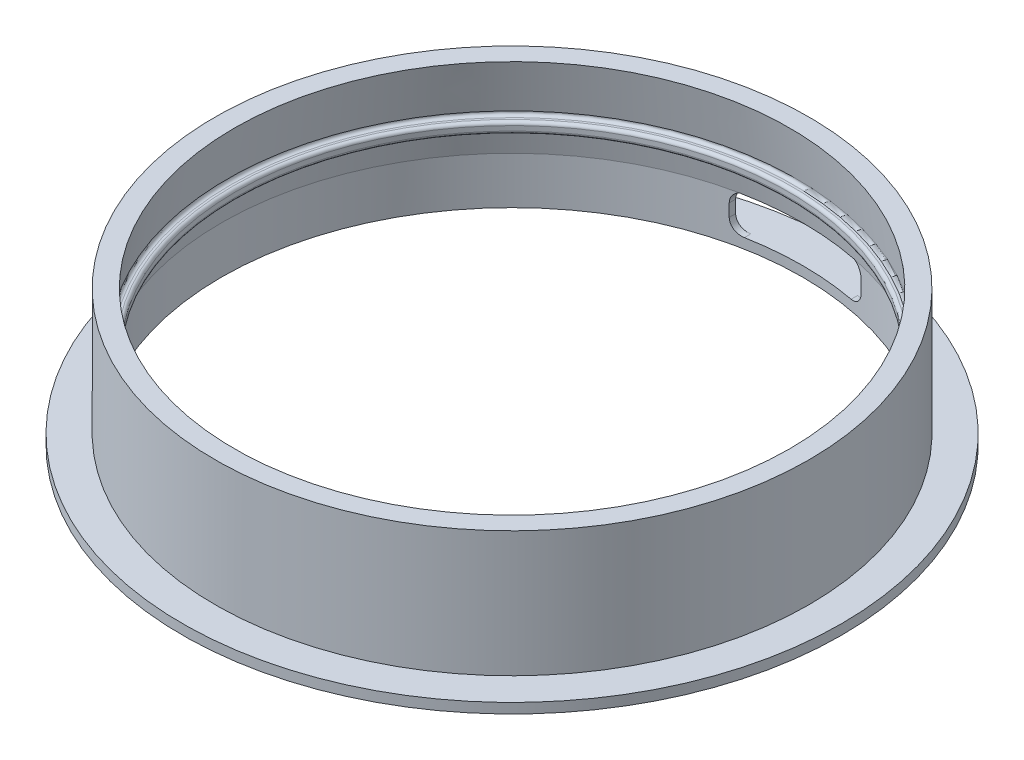
from build123d import *

# Parameters (mm, degrees)
CUT_EXTRUDE1_REACH      = 79.324
CUT_EXTRUDE1_END_RADIUS = 47.3
SKETCH4_W               = 21
SKETCH4_H               = 6
FILLET1_R               = 2
FILLET2_R               = 0.5


with BuildPart() as part:
    # Sketch2 → Revolve1 (revolve)
    with BuildSketch(Plane.XY):
        Polygon((46.3, 0), (46.3, 21.6), (47.3, 21.6), (47.3, 1.6), (52.5, 1.6), (52.5, 0), align=None)
    revolve(axis=Axis((0, -1000, 0), (0, 1, 0)))

    # Cut-Extrude1: up to this cylinder (the profile starts inside it)
    cut_extrude1_end = Plane(origin=(0, 4.6, 0), z_dir=(0, -1, 0)) * Cylinder(CUT_EXTRUDE1_END_RADIUS, 254.248, mode=Mode.PRIVATE)
    # Sketch4 → Cut-Extrude1 (cut, up to the surface)
    with BuildSketch(Plane.XY, mode=Mode.PRIVATE) as cut_extrude1_sk1:
        with Locations((0, 4.6)):
            Rectangle(SKETCH4_W, SKETCH4_H)
    cut_extrude1_tool1 = extrude(cut_extrude1_sk1.sketch, amount=-CUT_EXTRUDE1_REACH, mode=Mode.PRIVATE) & cut_extrude1_end
    add(cut_extrude1_tool1.solids().sort_by_distance((0, 4.6, 0))[0], mode=Mode.SUBTRACT)

    # Fillet1
    fillet1_edges = [part.edges().sort_by_distance(p)[0] for p in [
        (10.5, 1.6, -45.606762076),
        (-10.5, 7.6, -45.606762076),
        (10.5, 7.6, -45.606762076),
        (-10.5, 1.6, -45.606762076),
    ]]
    fillet(fillet1_edges, radius=FILLET1_R)

    # Sketch6 → Revolve2 (revolve)
    with BuildSketch(Plane.XY, mode=Mode.PRIVATE) as revolve2_sk:
        Polygon((-46.3, 7.5), (-44.243032454, 21.6), (-46.3, 21.6), align=None)
        Polygon((-45.431988872, 13.45), (-45.687286263, 11.7), (-44, 11.7), (-44, 13.45), align=None)
    revolve(revolve2_sk.sketch.rotate(Axis((0, -1000, 0), (0, 1, 0)), 180), axis=Axis((0, -1000, 0), (0, 1, 0)))

    # Fillet2
    fillet2_edges = [part.edges().sort_by_distance(p)[0] for p in [
        (-45.687286263, 11.7, 0),
        (-44, 11.7, 0),
        (-44, 13.45, 0),
        (-45.431988872, 13.45, 0),
    ]]
    fillet(fillet2_edges, radius=FILLET2_R)


solid = part.part
